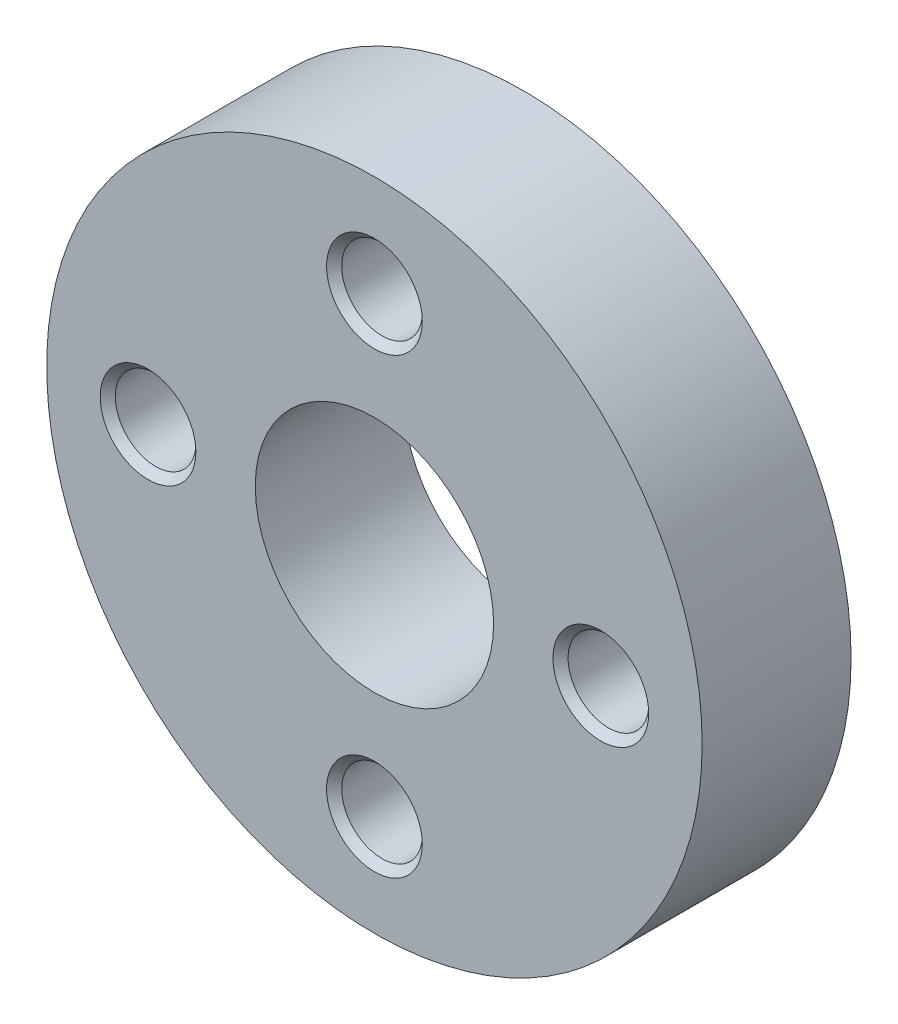
from build123d import *

# Parameters (mm, degrees)
SKETCH1_R             = 11
EXTRUDE1_DEPTH        = 2.5
F_6_32_TAPPED_HOLE3_D = 2.7051
CHAMFER1_SIZE         = 0.254
SKETCH2_R             = 4
EXTRUDE2_DEPTH        = 17.340134638


with BuildPart() as part:
    # Sketch1 → Extrude1 (new, symmetric)
    with BuildSketch(Plane.XY):
        Circle(SKETCH1_R)
    extrude(amount=EXTRUDE1_DEPTH, both=True)

    # #6-32 Tapped Hole3 (through all)
    with Locations(Plane(origin=(0, 7.599342077, 2.5), x_dir=(1, 0, 0), z_dir=(0, 0, 1))):
        with Locations((0, 0), (-7.599342077, -7.599342077), (7.599342077, -7.599342077), (0, -15.198684154)):
            Hole(F_6_32_TAPPED_HOLE3_D / 2)

    # Chamfer1
    chamfer1_edges = [part.edges().sort_by_distance(p)[0] for p in [
        (8.951892077, 0, 2.5),
        (8.951892077, 0, -2.5),
        (-6.246792077, 0, 2.5),
        (-6.246792077, 0, -2.5),
        (1.35255, 7.599342077, 2.5),
        (1.35255, 7.599342077, -2.5),
        (1.35255, -7.599342077, 2.5),
        (1.35255, -7.599342077, -2.5),
    ]]
    chamfer(chamfer1_edges, length=CHAMFER1_SIZE)

    # Sketch2 → Extrude2 (cut, through all)
    with BuildSketch(Plane.XY.offset(2.5)):
        Circle(SKETCH2_R)
    extrude(amount=-EXTRUDE2_DEPTH, mode=Mode.SUBTRACT)


solid = part.part
